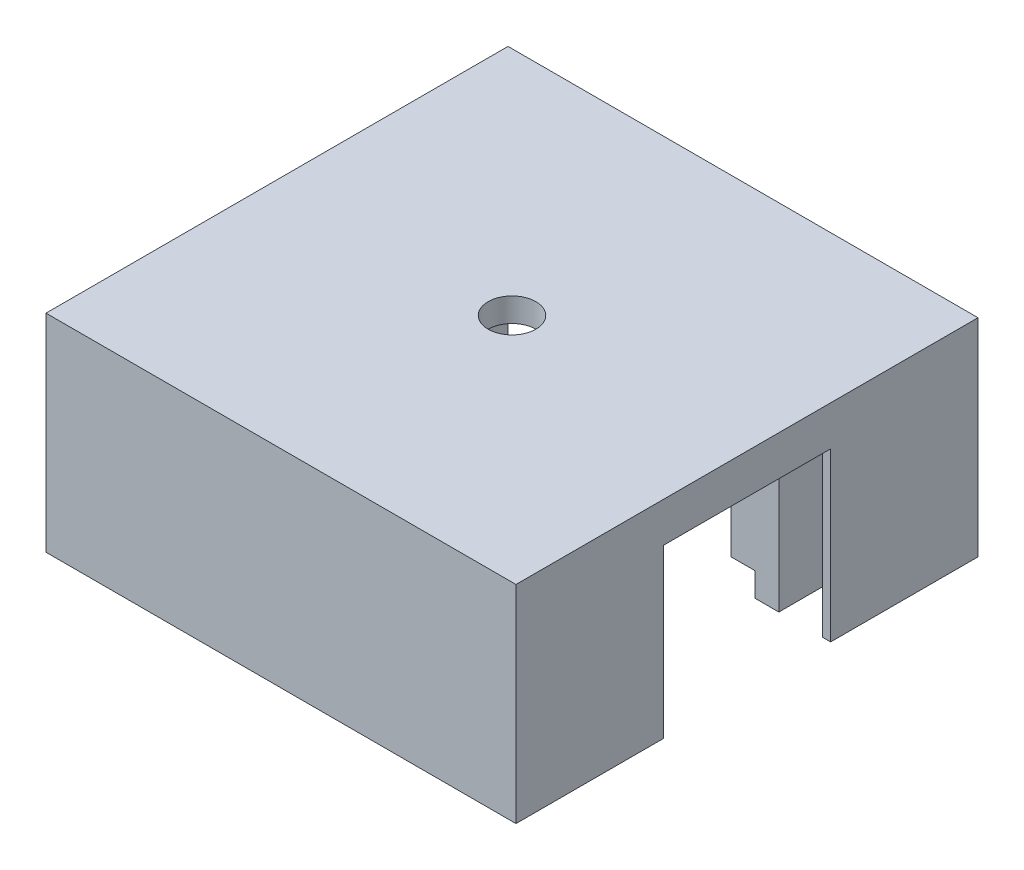
from build123d import *

# Parameters (mm, degrees)
SKETCH1_W            = 46
SKETCH1_H            = 33
BOSS_EXTRUDE1_DEPTH  = 23
CUT_EXTRUDE2_DEPTH   = 20
BOSS_EXTRUDE2_DEPTH  = 3
MIRROR2_COPY_1_DEPTH = 3
SKETCH6_W            = 6
SKETCH6_H            = 21
CUT_EXTRUDE3_DEPTH   = 20
SKETCH7_R            = 3
CUT_EXTRUDE5_DEPTH   = 37.47259245
SKETCH8_W            = 46
SKETCH8_H            = 3
BOSS_EXTRUDE3_DEPTH  = 6.5
SKETCH10_W           = 6
SKETCH10_H           = 21
BOSS_EXTRUDE4_DEPTH  = 20
CUT_EXTRUDE7_REACH   = 58.338
SKETCH11_W           = 21
SKETCH11_H           = 20
SKETCH13_W           = 46
SKETCH13_H           = 3
BOSS_EXTRUDE6_DEPTH  = 6.5
CUT_EXTRUDE8_DEPTH   = 1.5
SKETCH14_W           = 59
SKETCH14_H           = 3
BOSS_EXTRUDE7_DEPTH  = 6
SKETCH15_W           = 13
SKETCH15_H           = 0.75
CUT_EXTRUDE9_DEPTH   = 1.5
BOSS_EXTRUDE8_DEPTH  = 23
CUT_EXTRUDE11_REACH  = 71.016
SKETCH17_R           = 9.5
SKETCH17_W           = 57
SKETCH17_H           = 13.5
SKETCH20_W           = 53
SKETCH20_H           = 3.5
BOSS_EXTRUDE10_DEPTH = 11
SKETCH22_W           = 53
SKETCH22_H           = 1.5
CUT_EXTRUDE12_DEPTH  = 4
SKETCH23_W           = 12
SKETCH23_H           = 33
CUT_EXTRUDE13_DEPTH  = 20
SKETCH25_W           = 6.5
SKETCH25_H           = 21
BOSS_EXTRUDE11_DEPTH = 2
SKETCH27_W           = 53
SKETCH27_H           = 1
BOSS_EXTRUDE12_DEPTH = 12
SKETCH18_W           = 53
SKETCH18_H           = 1
BOSS_EXTRUDE13_DEPTH = 23
SKETCH33_W           = 12.5
SKETCH33_H           = 21
BOSS_EXTRUDE14_DEPTH = 2
CUT_EXTRUDE14_REACH  = 71.649
SKETCH34_W           = 4.5
SKETCH34_H           = 10


with BuildPart() as part:
    # Sketch1 → Boss-Extrude1 (new body)
    with BuildSketch(Plane(origin=(0, 0, 0), x_dir=(1, 0, 0), z_dir=(0, 1, 0))):
        Rectangle(SKETCH1_W, SKETCH1_H)
    extrude(amount=BOSS_EXTRUDE1_DEPTH)

    # Sketch3 → Cut-Extrude2 (cut)
    with BuildSketch(Plane.XZ):
        Polygon((-17, -10.5), (-17, -16.5), (5, -16.5), (5, -10.5), (17, -10.5), (17, 10.5), (5, 10.5), (5, 16.5), (-17, 16.5), (-17, 10.5), (-23, 10.5), (-23, -10.5), align=None)
    extrude(amount=-CUT_EXTRUDE2_DEPTH, mode=Mode.SUBTRACT)

    # Sketch5 → Boss-Extrude2 (add)
    with BuildSketch(Plane.XZ):
        Polygon((-17, 13.5), (-20, 13.5), (-20, 10.5), (-23, 10.5), (-23, 16.5), (-17, 16.5), align=None)
    boss_extrude2 = extrude(amount=BOSS_EXTRUDE2_DEPTH)

    # Mirror1: Boss-Extrude2 across plane
    add(boss_extrude2.mirror(Plane.XY))

    # Mirror2: Boss-Extrude2 across plane
    add(boss_extrude2.mirror(Plane(origin=(0, 0, 0), x_dir=(0, 0, 1), z_dir=(1, 0, 0))))

    # Mirror2 copy 1 sketch → Mirror2 copy 1 (add)
    with BuildSketch(Plane(origin=(0, 0, 0), x_dir=(-1, 0, 0), z_dir=(0, -1, 0))):
        Polygon((-17, 13.5), (-20, 13.5), (-20, 10.5), (-23, 10.5), (-23, 16.5), (-17, 16.5), align=None)
    extrude(amount=MIRROR2_COPY_1_DEPTH)

    # Sketch6 → Cut-Extrude3 (cut)
    with BuildSketch(Plane.XZ):
        with Locations((20, 0)):
            Rectangle(SKETCH6_W, SKETCH6_H)
    extrude(amount=-CUT_EXTRUDE3_DEPTH, mode=Mode.SUBTRACT)

    # Sketch7 → Cut-Extrude5 (cut, through all)
    with BuildSketch(Plane.XZ.offset(-20)):
        with Locations(Location((0, 0, 0), (0, 0, 270))):
            Circle(SKETCH7_R)
    extrude(amount=-CUT_EXTRUDE5_DEPTH, mode=Mode.SUBTRACT)

    # Sketch8 → Boss-Extrude3 (add)
    with BuildSketch(Plane(origin=(0, 0, -16.5), x_dir=(-1, 0, 0), z_dir=(0, 0, -1))):
        with Locations((0, 21.5)):
            Rectangle(SKETCH8_W, SKETCH8_H)
    boss_extrude3 = extrude(amount=BOSS_EXTRUDE3_DEPTH)

    # Mirror3: Boss-Extrude3 across plane
    add(boss_extrude3.mirror(Plane.XY))

    # Sketch10 → Boss-Extrude4 (add)
    with BuildSketch(Plane.XZ.offset(-20)):
        with Locations((-20, 0)):
            Rectangle(SKETCH10_W, SKETCH10_H)
    extrude(amount=BOSS_EXTRUDE4_DEPTH)

    # Sketch11 → Cut-Extrude7 (cut, up to next)
    with BuildSketch(Plane.ZY.offset(23), mode=Mode.PRIVATE) as cut_extrude7_sk1:
        with Locations((0, 8)):
            Rectangle(SKETCH11_W, SKETCH11_H)
    cut_extrude7_tool1 = extrude(cut_extrude7_sk1.sketch, amount=-CUT_EXTRUDE7_REACH, mode=Mode.PRIVATE) & part.part
    add(cut_extrude7_tool1.solids().sort_by_distance((-23, 8, 0))[0], mode=Mode.SUBTRACT)

    # Sketch13 → Boss-Extrude6 (add)
    with BuildSketch(Plane(origin=(23, 0, 0), x_dir=(0, 0, -1), z_dir=(1, 0, 0))):
        with Locations((0, 21.5)):
            Rectangle(SKETCH13_W, SKETCH13_H)
    boss_extrude6 = extrude(amount=BOSS_EXTRUDE6_DEPTH)

    # Mirror4: Boss-Extrude6 across plane
    add(boss_extrude6.mirror(Plane(origin=(0, 0, 0), x_dir=(0, 0, 1), z_dir=(1, 0, 0))))

    # Sketch12 → Cut-Extrude8 (cut)
    with BuildSketch(Plane.XZ.offset(-20)):
        Polygon((-6.5, -20.5), (-6.5, -23), (6.5, -23), (6.5, -20.5), (26, -20.5), (26, -19), (-26, -19), (-26, -20.5), align=None)
    extrude(amount=-CUT_EXTRUDE8_DEPTH, mode=Mode.SUBTRACT)

    # Sketch14 → Boss-Extrude7 (add)
    with BuildSketch(Plane(origin=(0, 0, -23), x_dir=(-1, 0, 0), z_dir=(0, 0, -1))):
        with Locations((0, 21.5)):
            Rectangle(SKETCH14_W, SKETCH14_H)
    boss_extrude7 = extrude(amount=BOSS_EXTRUDE7_DEPTH)

    # Mirror5: Boss-Extrude7 across plane
    add(boss_extrude7.mirror(Plane.XY))

    # Sketch15 → Cut-Extrude9 (cut)
    with BuildSketch(Plane.XZ.offset(-20)):
        with Locations((0, -23.375)):
            Rectangle(SKETCH15_W, SKETCH15_H)
    extrude(amount=-CUT_EXTRUDE9_DEPTH, mode=Mode.SUBTRACT)

    # Sketch16 → Boss-Extrude8 (add)
    with BuildSketch(Plane.XZ.offset(-20)):
        Polygon((-28.5, 28), (-26.5, 28), (-26.5, 29), (-29.5, 29), (-29.5, 10.5), (-28.5, 10.5), align=None)
        Polygon((26.5, 28), (28.5, 28), (28.5, 10.5), (29.5, 10.5), (29.5, 29), (26.5, 29), align=None)
        Polygon((29.5, -10.5), (28.5, -10.5), (28.5, -28), (-28.5, -28), (-28.5, -10.5), (-29.5, -10.5), (-29.5, -29), (29.5, -29), align=None)
    extrude(amount=BOSS_EXTRUDE8_DEPTH)

    # Sketch17 → Cut-Extrude11 (cut, up to next)
    with BuildSketch(Plane(origin=(0, 0, -29), x_dir=(-1, 0, 0), z_dir=(0, 0, -1)), mode=Mode.PRIVATE) as cut_extrude11_sk1:
        with Locations((13, 10.5)):
            Circle(SKETCH17_R)
    cut_extrude11_tool1 = extrude(cut_extrude11_sk1.sketch, amount=-CUT_EXTRUDE11_REACH, mode=Mode.PRIVATE) & part.part
    # Sketch17 → Cut-Extrude11 (cut, up to next)
    with BuildSketch(Plane(origin=(0, 0, -29), x_dir=(-1, 0, 0), z_dir=(0, 0, -1)), mode=Mode.PRIVATE) as cut_extrude11_sk2:
        with Locations((-13, 10.5)):
            Circle(SKETCH17_R)
    cut_extrude11_tool2 = extrude(cut_extrude11_sk2.sketch, amount=-CUT_EXTRUDE11_REACH, mode=Mode.PRIVATE) & part.part
    # Sketch17 → Cut-Extrude11 (cut, up to next)
    with BuildSketch(Plane(origin=(0, 0, -29), x_dir=(-1, 0, 0), z_dir=(0, 0, -1)), mode=Mode.PRIVATE) as cut_extrude11_sk3:
        with Locations((0, 3.75)):
            Rectangle(SKETCH17_W, SKETCH17_H)
    cut_extrude11_tool3 = extrude(cut_extrude11_sk3.sketch, amount=-CUT_EXTRUDE11_REACH, mode=Mode.PRIVATE) & part.part
    add(cut_extrude11_tool1.solids().sort_by_distance((-13, 10.5, -29))[0], mode=Mode.SUBTRACT)
    add(cut_extrude11_tool2.solids().sort_by_distance((13, 10.5, -29))[0], mode=Mode.SUBTRACT)
    add(cut_extrude11_tool3.solids().sort_by_distance((0, 3.75, -29))[0], mode=Mode.SUBTRACT)

    # Sketch20 → Boss-Extrude10 (add)
    with BuildSketch(Plane.XZ.offset(-20)):
        with Locations((0, 20.25)):
            Rectangle(SKETCH20_W, SKETCH20_H)
    extrude(amount=BOSS_EXTRUDE10_DEPTH)

    # Sketch22 → Cut-Extrude12 (cut)
    with BuildSketch(Plane.XZ.offset(-9)):
        with Locations((0, 20.25)):
            Rectangle(SKETCH22_W, SKETCH22_H)
    extrude(amount=-CUT_EXTRUDE12_DEPTH, mode=Mode.SUBTRACT)

    # Sketch23 → Cut-Extrude13 (cut)
    with BuildSketch(Plane.XZ):
        with Locations((11, 0)):
            Rectangle(SKETCH23_W, SKETCH23_H)
    extrude(amount=-CUT_EXTRUDE13_DEPTH, mode=Mode.SUBTRACT)

    # Sketch25 → Boss-Extrude11 (add)
    with BuildSketch(Plane.XZ.offset(-20)):
        with Locations((-26.25, 0)):
            Rectangle(SKETCH25_W, SKETCH25_H)
    extrude(amount=BOSS_EXTRUDE11_DEPTH)

    # Sketch27 → Boss-Extrude12 (add)
    with BuildSketch(Plane.XZ.offset(-9)):
        with Locations((0, 21.5)):
            Rectangle(SKETCH27_W, SKETCH27_H)
    extrude(amount=BOSS_EXTRUDE12_DEPTH)

    # Sketch18 → Boss-Extrude13 (add)
    with BuildSketch(Plane.XZ.offset(-20)):
        with Locations((0, 28.5)):
            Rectangle(SKETCH18_W, SKETCH18_H)
    extrude(amount=BOSS_EXTRUDE13_DEPTH)

    # Sketch33 → Boss-Extrude14 (add)
    with BuildSketch(Plane.XZ.offset(-20)):
        with Locations((23.25, 0)):
            Rectangle(SKETCH33_W, SKETCH33_H)
    extrude(amount=BOSS_EXTRUDE14_DEPTH)

    # Sketch34 → Cut-Extrude14 (cut, up to next)
    with BuildSketch(Plane.ZY.offset(29.5), mode=Mode.PRIVATE) as cut_extrude14_sk1:
        with Locations((18.75, 2)):
            Rectangle(SKETCH34_W, SKETCH34_H)
    cut_extrude14_tool1 = extrude(cut_extrude14_sk1.sketch, amount=-CUT_EXTRUDE14_REACH, mode=Mode.PRIVATE) & part.part
    add(cut_extrude14_tool1.solids().sort_by_distance((-29.5, 2, 18.75))[0], mode=Mode.SUBTRACT)


solid = part.part
